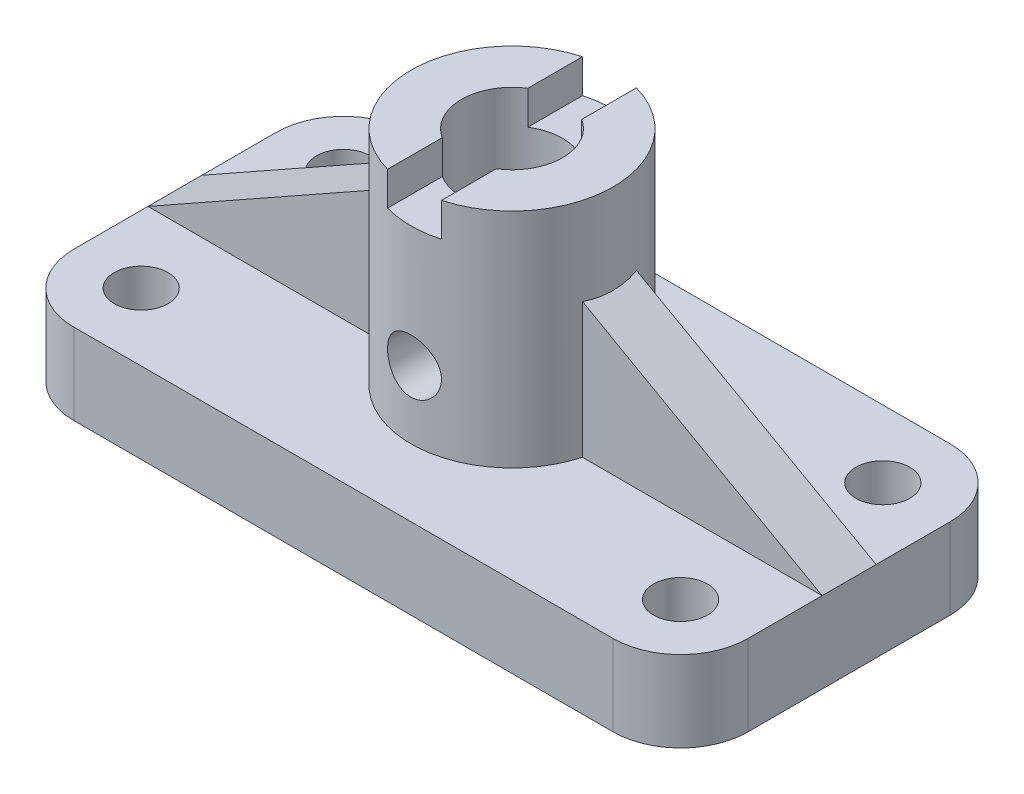
from build123d import *

# Parameters (mm, degrees)
SKETCH_1_W               = 100
SKETCH_1_H               = 50
SKETCH_1_R               = 4
EXTRUDE_1_DEPTH          = 12
FILLET_1_R               = 10
FILLET_2_R               = 10
SKETCH_2_R               = 15
EXTRUDE_2_DEPTH          = 33
SKETCH_3_R               = 7.5
CUT_EXTRUDE_1_DEPTH      = 72.763500472
CUT_EXTRUDE_START        = -10
SKETCH_4_W               = 8
SKETCH_4_H               = 45
CUT_EXTRUDE_2_DEPTH      = 5
CUT_EXTRUDE_3_DEPTH      = 79.262379212
CUT_EXTRUDE_3_DEPTH_BACK = 79.262379212
SKETCH_5_R               = 4
EXTRUDE_3_DEPTH          = 8


with BuildPart() as part:
    # 草图1 → 凸台-拉伸1 (new body)
    with BuildSketch(Plane(origin=(0, 0, 0), x_dir=(1, 0, 0), z_dir=(0, 1, 0))):
        Rectangle(SKETCH_1_W, SKETCH_1_H)
        with Locations(Location((-40, 15, 0), (0, 0, 270))):
            Circle(SKETCH_1_R, mode=Mode.SUBTRACT)
        with Locations(Location((-40, -15, 0), (0, 0, 90))):
            Circle(SKETCH_1_R, mode=Mode.SUBTRACT)
        with Locations(Location((40, -15, 0), (0, 0, 270))):
            Circle(SKETCH_1_R, mode=Mode.SUBTRACT)
        with Locations(Location((40, 15, 0), (0, 0, 90))):
            Circle(SKETCH_1_R, mode=Mode.SUBTRACT)
    extrude(amount=EXTRUDE_1_DEPTH)

    # 圆角1
    fillet_1_edges = [part.edges().sort_by_distance(p)[0] for p in [
        (50, 6, -25),
    ]]
    fillet(fillet_1_edges, radius=FILLET_1_R)

    # 圆角2
    fillet_2_edges = [part.edges().sort_by_distance(p)[0] for p in [
        (-50, 6, -25),
        (50, 6, 25),
        (-50, 6, 25),
    ]]
    fillet(fillet_2_edges, radius=FILLET_2_R)

    # 草图2 → 凸台-拉伸2 (add)
    with BuildSketch(Plane(origin=(0, 12, 0), x_dir=(1, 0, 0), z_dir=(0, 1, 0))):
        with Locations(Location((0, 0, 0), (0, 0, 270))):
            Circle(SKETCH_2_R)
    extrude(amount=EXTRUDE_2_DEPTH)

    # 草图3 → 切除-拉伸1 (cut, through all)
    with BuildSketch(Plane(origin=(0, 45, 0), x_dir=(1, 0, 0), z_dir=(0, 1, 0))):
        with Locations(Location((0, 0, 0), (0, 0, 270))):
            Circle(SKETCH_3_R)
    extrude(amount=-CUT_EXTRUDE_1_DEPTH, mode=Mode.SUBTRACT)

    # 草图4 → 切除-拉伸2 (cut)
    with BuildSketch(Plane(origin=(0, 55, 0), x_dir=(1, 0, 0), z_dir=(0, 1, 0)).offset(CUT_EXTRUDE_START)):
        Rectangle(SKETCH_4_W, SKETCH_4_H)
    extrude(amount=-CUT_EXTRUDE_2_DEPTH, mode=Mode.SUBTRACT)

    # 草图5 → 切除-拉伸3 (cut, two sides: drawn at the far end of the back side and taken through both)
    with BuildSketch(Plane.XY.offset(15).offset(-CUT_EXTRUDE_3_DEPTH_BACK)):
        with Locations((0, 22)):
            Circle(SKETCH_5_R)
    extrude(amount=CUT_EXTRUDE_3_DEPTH + CUT_EXTRUDE_3_DEPTH_BACK, mode=Mode.SUBTRACT)

    # 草图8 → 凸台-拉伸3 (add)
    with BuildSketch(Plane.XY.offset(4)):
        Polygon((-50, 12), (-14.456832295, 12), (-14.456832295, 32), align=None)
    extrude_3 = extrude(amount=-EXTRUDE_3_DEPTH)

    # 镜向1: 凸台-拉伸3 across plane
    add(extrude_3.mirror(Plane(origin=(0, 0, 0), x_dir=(0, 0, 1), z_dir=(1, 0, 0))))


solid = part.part
